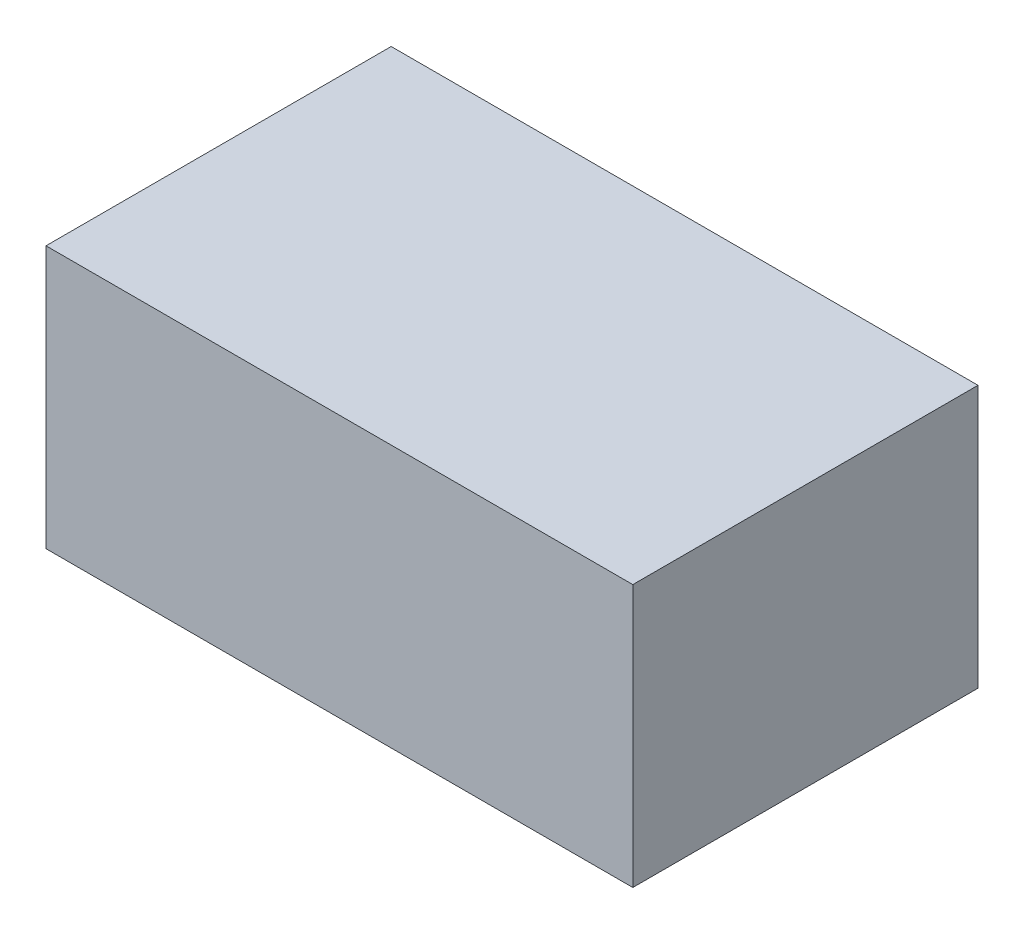
from build123d import *

# Parameters (mm, degrees)
ESQUISSE1_W        = 53.975
ESQUISSE1_H        = 31.75
BOSS_EXTRU_1_DEPTH = 12.065


with BuildPart() as part:
    # Esquisse1 → Boss.-Extru.1 (new, symmetric)
    with BuildSketch(Plane(origin=(0, 0, 0), x_dir=(1, 0, 0), z_dir=(0, 1, 0))):
        with Locations((26.9875, 15.875)):
            Rectangle(ESQUISSE1_W, ESQUISSE1_H)
    extrude(amount=BOSS_EXTRU_1_DEPTH, both=True)


solid = part.part
